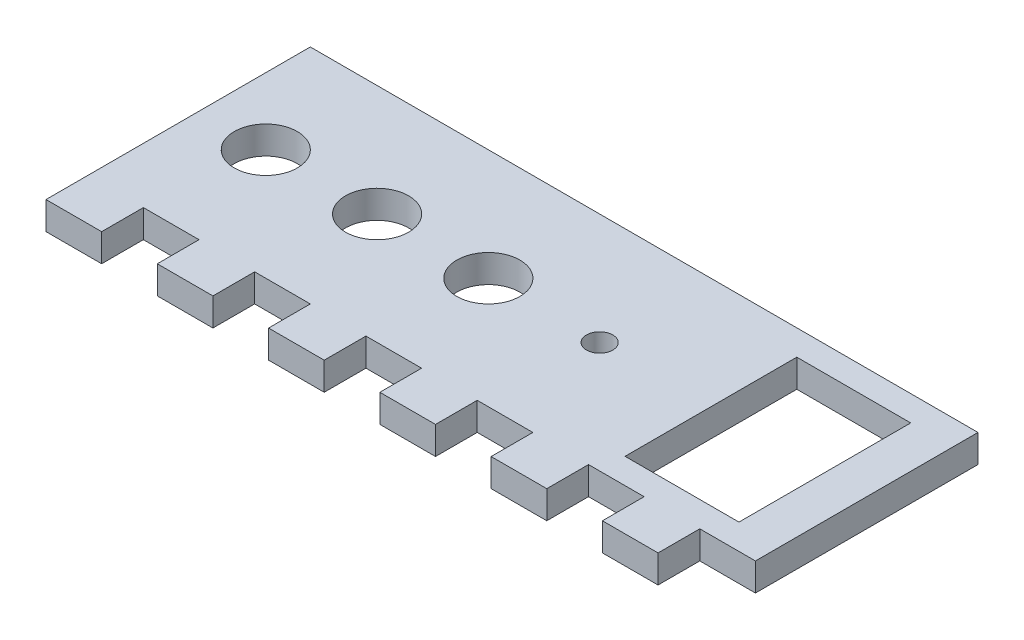
from build123d import *

# Parameters (mm, degrees)
SKETCH1_R           = 3.6
SKETCH1_R_2         = 1.5
SKETCH1_W           = 13
SKETCH1_H           = 19.6
BOSS_EXTRUDE1_DEPTH = 3.175


with BuildPart() as part:
    # Sketch1 → Boss-Extrude1 (new body)
    with BuildSketch(Plane(origin=(0, 0, 0), x_dir=(1, 0, 0), z_dir=(0, 1, 0))):
        Polygon((0, 0), (0, -4.7625), (6.35, -4.7625), (6.35, 0), (12.7, 0), (12.7, -4.7625), (19.05, -4.7625), (19.05, 0), (25.4, 0), (25.4, -4.7625), (31.75, -4.7625), (31.75, 0), (38.1, 0), (38.1, -4.7625), (44.45, -4.7625), (44.45, 0), (50.8, 0), (50.8, -4.7625), (57.15, -4.7625), (57.15, 0), (63.5, 0), (63.5, -4.7625), (69.85, -4.7625), (69.85, 0), (76.2, 0), (76.2, 25.4), (0, 25.4), align=None)
        with Locations(Location((7.62, 12.7, 0), (0, 0, 270))):
            Circle(SKETCH1_R, mode=Mode.SUBTRACT)
        with Locations(Location((20.32, 12.7, 0), (0, 0, 270))):
            Circle(SKETCH1_R, mode=Mode.SUBTRACT)
        with Locations(Location((33.02, 12.7, 0), (0, 0, 270))):
            Circle(SKETCH1_R, mode=Mode.SUBTRACT)
        with Locations(Location((45.72, 12.7, 0), (0, 0, 270))):
            Circle(SKETCH1_R_2, mode=Mode.SUBTRACT)
        with Locations((64.92, 12.7)):
            Rectangle(SKETCH1_W, SKETCH1_H, mode=Mode.SUBTRACT)
    extrude(amount=BOSS_EXTRUDE1_DEPTH)


solid = part.part
